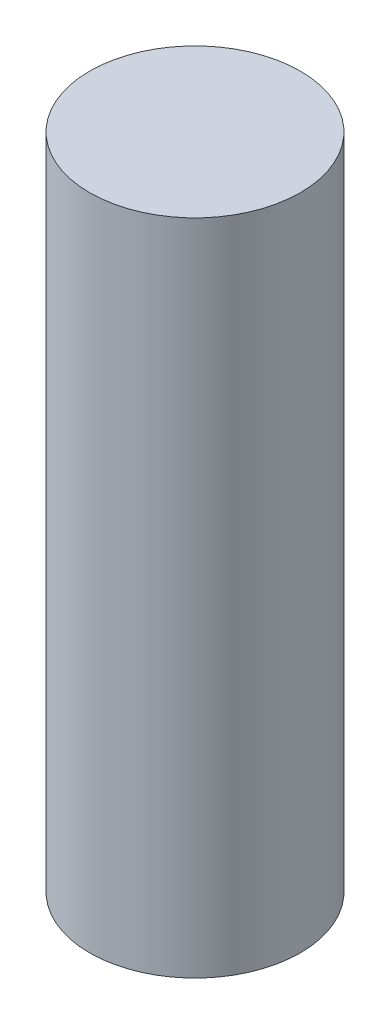
from build123d import *

# Parameters (mm, degrees)
SKETCH1_R           = 2.4
BOSS_EXTRUDE1_DEPTH = 15


with BuildPart() as part:
    # Sketch1 → Boss-Extrude1 (new body)
    with BuildSketch(Plane(origin=(0, 0, 0), x_dir=(1, 0, 0), z_dir=(0, 1, 0))):
        with Locations(Location((0, 0, 0), (0, 0, 270))):
            Circle(SKETCH1_R)
    extrude(amount=BOSS_EXTRUDE1_DEPTH)


solid = part.part
